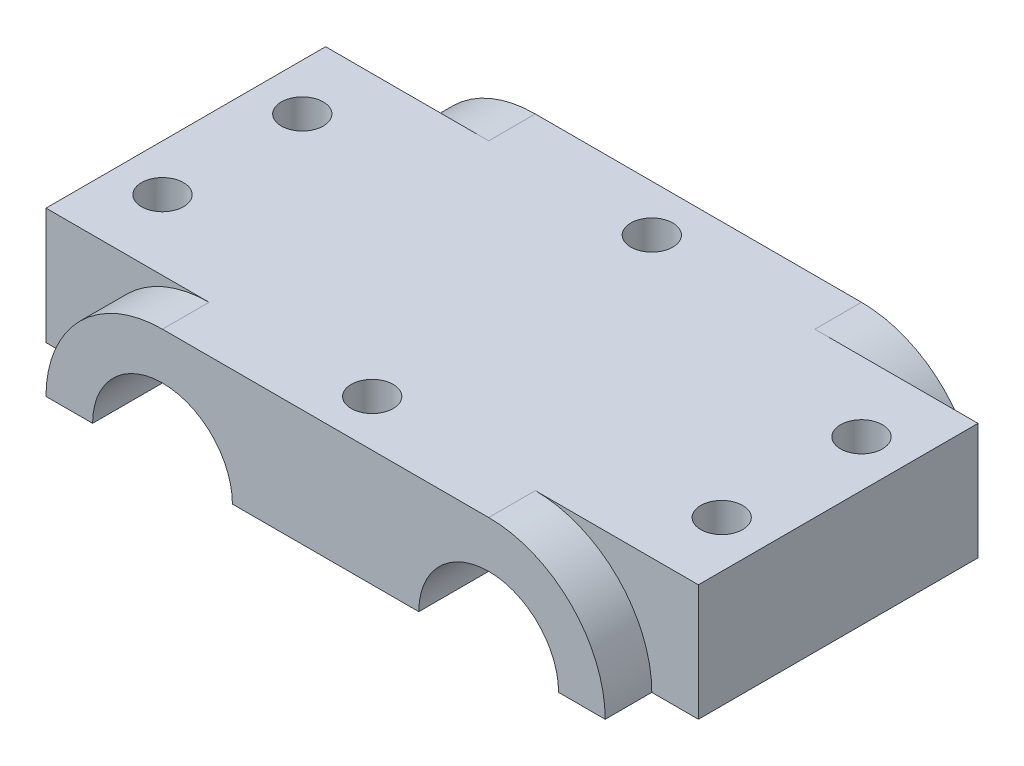
from build123d import *

# Parameters (mm, degrees)
SKETCH1_W           = 70
SKETCH1_H           = 12.5
BOSS_EXTRUDE1_DEPTH = 30
BOSS_EXTRUDE2_DEPTH = 40
CUT_EXTRUDE1_DEPTH  = 40
SKETCH6_R           = 2.25
CUT_EXTRUDE2_DEPTH  = 40


with BuildPart() as part:
    # Sketch1 → Boss-Extrude1 (new body)
    with BuildSketch(Plane.XY):
        with Locations((35, 6.25)):
            Rectangle(SKETCH1_W, SKETCH1_H)
    extrude(amount=BOSS_EXTRUDE1_DEPTH)

    # Sketch2 → Boss-Extrude2 (add)
    with BuildSketch(Plane.XY.offset(-5)):
        with BuildLine():
            Line((35, 0), (25, 0))
            ThreePointArc((25, 0), (17.5, 7.5), (10, 0))
            Line((10, 0), (5, 0))
            ThreePointArc((5, 0), (8.661165235, 8.838834765), (17.5, 12.5))
            Line((17.5, 12.5), (52.5, 12.5))
            ThreePointArc((52.5, 12.5), (61.338834765, 8.838834765), (65, 0))
            Line((65, 0), (60, 0))
            ThreePointArc((60, 0), (52.5, 7.5), (45, 0))
            Line((45, 0), (35, 0))
        make_face()
    extrude(amount=BOSS_EXTRUDE2_DEPTH)

    # Sketch5 → Cut-Extrude1 (cut)
    with BuildSketch(Plane(origin=(0, 0, 0), x_dir=(-1, 0, 0), z_dir=(0, 0, -1))):
        with BuildLine():
            Line((-25, 0), (-10, 0))
            ThreePointArc((-10, 0), (-17.5, 7.5), (-25, 0))
        make_face()
        with BuildLine():
            Line((-60, 0), (-45, 0))
            ThreePointArc((-45, 0), (-52.5, 7.5), (-60, 0))
        make_face()
    extrude(amount=-CUT_EXTRUDE1_DEPTH, mode=Mode.SUBTRACT)

    # Sketch6 → Cut-Extrude2 (cut)
    with BuildSketch(Plane(origin=(0, 12.5, 0), x_dir=(1, 0, 0), z_dir=(0, 1, 0))):
        with Locations(Location((5, -7.5, 0), (0, 0, 270))):
            Circle(SKETCH6_R)
        with Locations(Location((5, -22.5, 0), (0, 0, 270))):
            Circle(SKETCH6_R)
        with Locations(Location((35, 0, 0), (0, 0, 270))):
            Circle(SKETCH6_R)
        with Locations(Location((35, -30, 0), (0, 0, 270))):
            Circle(SKETCH6_R)
        with Locations(Location((65, -7.5, 0), (0, 0, 270))):
            Circle(SKETCH6_R)
        with Locations(Location((65, -22.5, 0), (0, 0, 270))):
            Circle(SKETCH6_R)
    extrude(amount=-CUT_EXTRUDE2_DEPTH, mode=Mode.SUBTRACT)


solid = part.part
